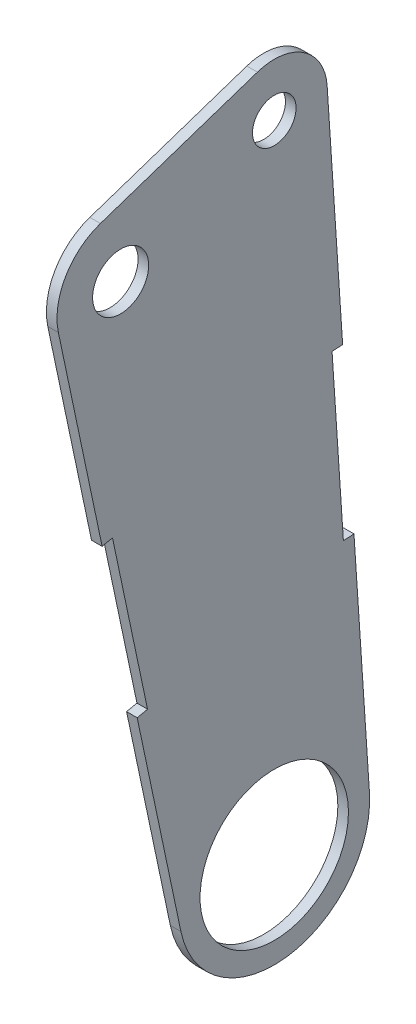
from build123d import *

# Parameters (mm, degrees)
SKETCH1_R               = 11.1125
BOSS_EXTRUDE1_DEPTH     = 1.5875
F_1_4_CLEARANCE_HOLE1_D = 6.5278
M8_CLEARANCE_HOLE1_D    = 8.4
BOSS_EXTRUDE2_DEPTH     = 1.5875


with BuildPart() as part:
    # Sketch1 → Boss-Extrude1 (new body)
    with BuildSketch(Plane(origin=(0, 0, 0), x_dir=(0, 0, -1), z_dir=(1, 0, 0))):
        with BuildLine():
            ThreePointArc((-26.033578217, 94.902839555), (-31.276267612, 90.601358567), (-32.328311992, 83.901975506))
            Line((-32.328311992, 83.901975506), (-25.778737426, 52.900096757))
            Line((-25.778737426, 52.900096757), (-24.225520946, 53.228235166))
            Line((-24.225520946, 53.228235166), (-18.975306409, 28.37677148))
            Line((-18.975306409, 28.37677148), (-20.528522889, 28.048633072))
            Line((-20.528522889, 28.048633072), (-13.978948323, -2.953245677))
            ThreePointArc((-13.978948323, -2.953245677), (1.957769706, -14.152730974), (14.255714644, 0.9525))
            Line((14.255714644, 0.9525), (11.936332499, 35.665833333))
            Line((11.936332499, 35.665833333), (10.352364205, 35.56))
            Line((10.352364205, 35.56), (8.655255319, 60.96))
            Line((8.655255319, 60.96), (10.239223613, 61.065833333))
            Line((10.239223613, 61.065833333), (7.919841469, 95.779166667))
            ThreePointArc((7.919841469, 95.779166667), (4.41923637, 101.843501055), (-2.520470923, 102.776694665))
            Line((-2.520470923, 102.776694665), (-5.244990973, 101.864332217))
            Line((-5.244990973, 101.864332217), (-4.740896788, 100.358993285))
            Line((-4.740896788, 100.358993285), (-22.804963983, 94.309863069))
            Line((-22.804963983, 94.309863069), (-23.309058168, 95.815202002))
            Line((-23.309058168, 95.815202002), (-26.033578217, 94.902839555))
        make_face()
        Circle(SKETCH1_R, mode=Mode.SUBTRACT)
    extrude(amount=BOSS_EXTRUDE1_DEPTH)

    # 1/4 Clearance Hole1 (through all)
    with Locations(Plane(origin=(1.5875, 0, 0), x_dir=(0, 0, -1), z_dir=(1, 0, 0))):
        with Locations((0, 95.25)):
            Hole(F_1_4_CLEARANCE_HOLE1_D / 2)

    # M8 Clearance Hole1 (through all)
    with Locations(Plane(origin=(1.5875, 0, 0), x_dir=(0, 0, -1), z_dir=(1, 0, 0))):
        with Locations((-23.00901311, 85.870805957)):
            Hole(M8_CLEARANCE_HOLE1_D / 2)

    # Sketch1<3> → Boss-Extrude2 (add)
    with BuildSketch(Plane(origin=(0, 0, 0), x_dir=(0, 0, -1), z_dir=(1, 0, 0))):
        Polygon((-5.244990973, 101.864332217), (-23.309058168, 95.815202002), (-22.804963983, 94.309863069), (-4.740896788, 100.358993285), align=None)
    extrude(amount=BOSS_EXTRUDE2_DEPTH)


solid = part.part
